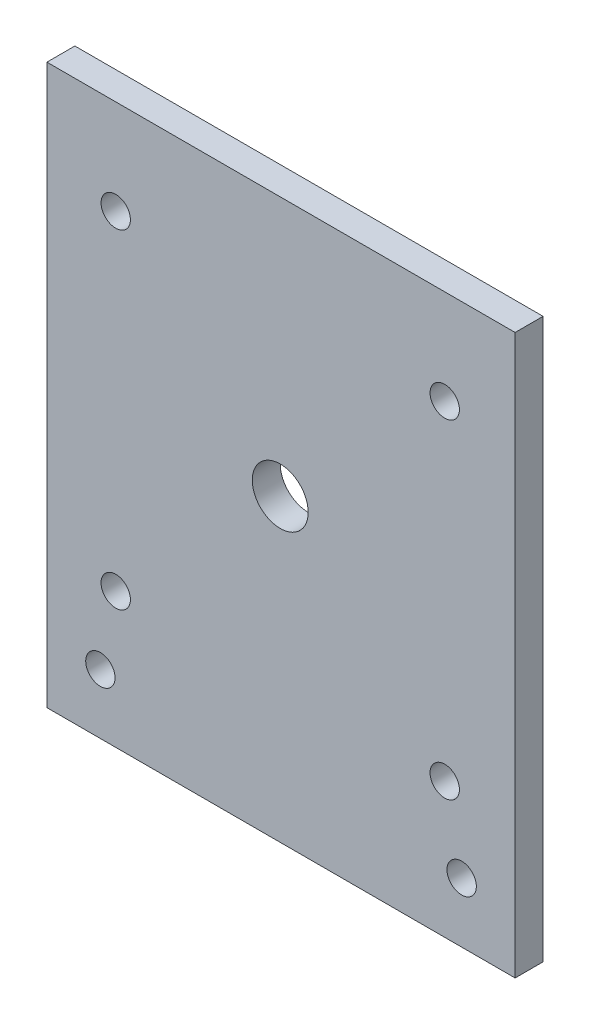
from build123d import *

# Parameters (mm, degrees)
ESQUISSE1_W             = 65
ESQUISSE1_H             = 80
BOSS_EXTRU_1_DEPTH      = 4
ESQUISSE2_R             = 2.1
ENL_V_MAT_EXTRU_1_DEPTH = 52.693810074
ESQUISSE3_R             = 2.1
ESQUISSE3_R_2           = 4
ENL_V_MAT_EXTRU_2_DEPTH = 52.693810074
ESQUISSE4_W             = 1
ESQUISSE4_H             = 80
BOSS_EXTRU_2_DEPTH      = 4


with BuildPart() as part:
    # Esquisse1 → Boss.-Extru.1 (new body)
    with BuildSketch(Plane.XY):
        Rectangle(ESQUISSE1_W, ESQUISSE1_H)
    extrude(amount=BOSS_EXTRU_1_DEPTH)

    # Esquisse2 → Enlèv. mat.-Extru.1 (cut, through all)
    with BuildSketch(Plane(origin=(0, 0, 0), x_dir=(-1, 0, 0), z_dir=(0, 0, -1))):
        with Locations((25.85, -31.43902252)):
            Circle(ESQUISSE2_R)
        with Locations(Location((-25.85, -31.43902252, 0), (0, 0, 180))):
            Circle(ESQUISSE2_R)
    extrude(amount=-ENL_V_MAT_EXTRU_1_DEPTH, mode=Mode.SUBTRACT)

    # Esquisse3 → Enlèv. mat.-Extru.2 (cut, through all)
    with BuildSketch(Plane.XY.offset(4)):
        with Locations((-23.653359533, -20.639976695)):
            Circle(ESQUISSE3_R)
        with Locations((23.426593857, -20.639976695)):
            Circle(ESQUISSE3_R)
        with Locations((23.426593857, 26.439976695)):
            Circle(ESQUISSE3_R)
        with Locations((-23.653359533, 26.439976695)):
            Circle(ESQUISSE3_R)
        with Locations((-0.113382838, 2.9)):
            Circle(ESQUISSE3_R_2)
    extrude(amount=-ENL_V_MAT_EXTRU_2_DEPTH, mode=Mode.SUBTRACT)

    # Esquisse4 → Boss.-Extru.2 (add)
    with BuildSketch(Plane(origin=(0, 0, 0), x_dir=(-1, 0, 0), z_dir=(0, 0, -1))):
        with Locations((33, 0)):
            Rectangle(ESQUISSE4_W, ESQUISSE4_H)
        with Locations((-33, 0)):
            Rectangle(ESQUISSE4_W, ESQUISSE4_H)
    extrude(amount=-BOSS_EXTRU_2_DEPTH)


solid = part.part
